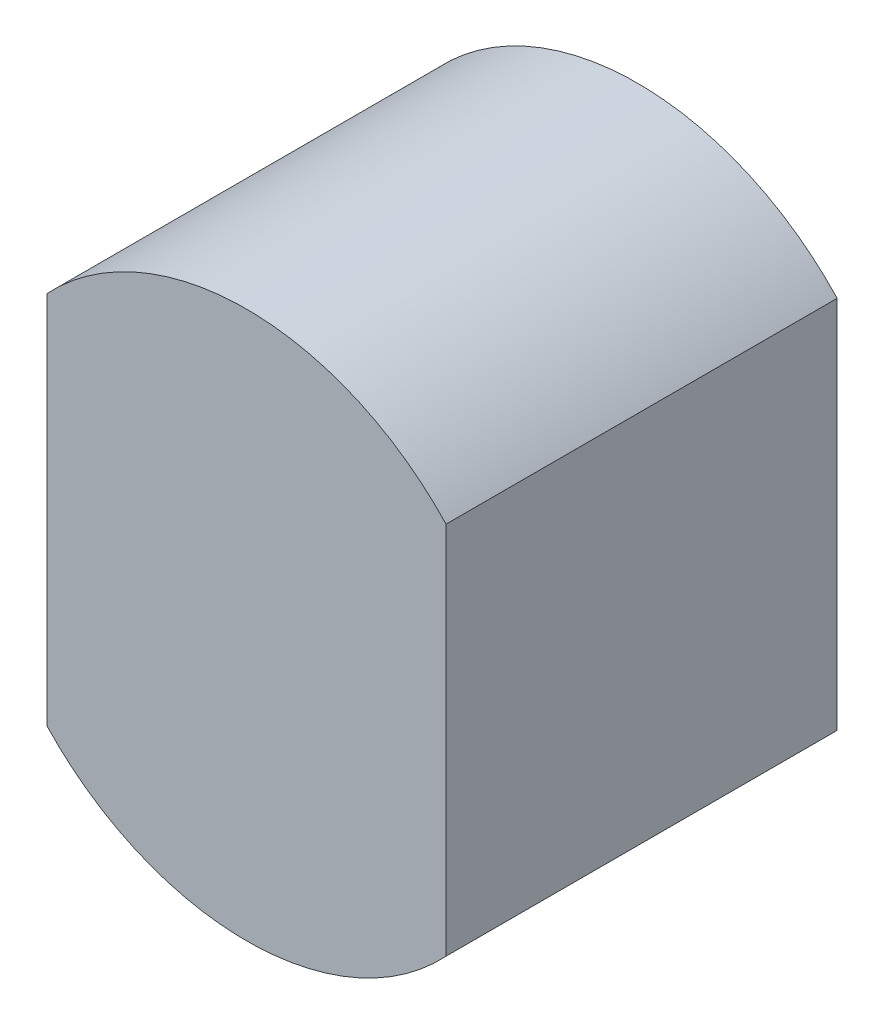
from build123d import *

# Parameters (mm, degrees)
BOSS_EXTRUDE1_DEPTH = 49.022


with BuildPart() as part:
    # Sketch1 → Boss-Extrude1 (new body)
    with BuildSketch(Plane.XY):
        with BuildLine():
            Line((25.019, 23.448960297), (25.019, -23.448960297))
            ThreePointArc((25.019, -23.448960297), (0, -34.29), (-25.019, -23.448960297))
            Line((-25.019, -23.448960297), (-25.019, 23.448960297))
            ThreePointArc((-25.019, 23.448960297), (0, 34.29), (25.019, 23.448960297))
        make_face()
    extrude(amount=BOSS_EXTRUDE1_DEPTH)


solid = part.part
